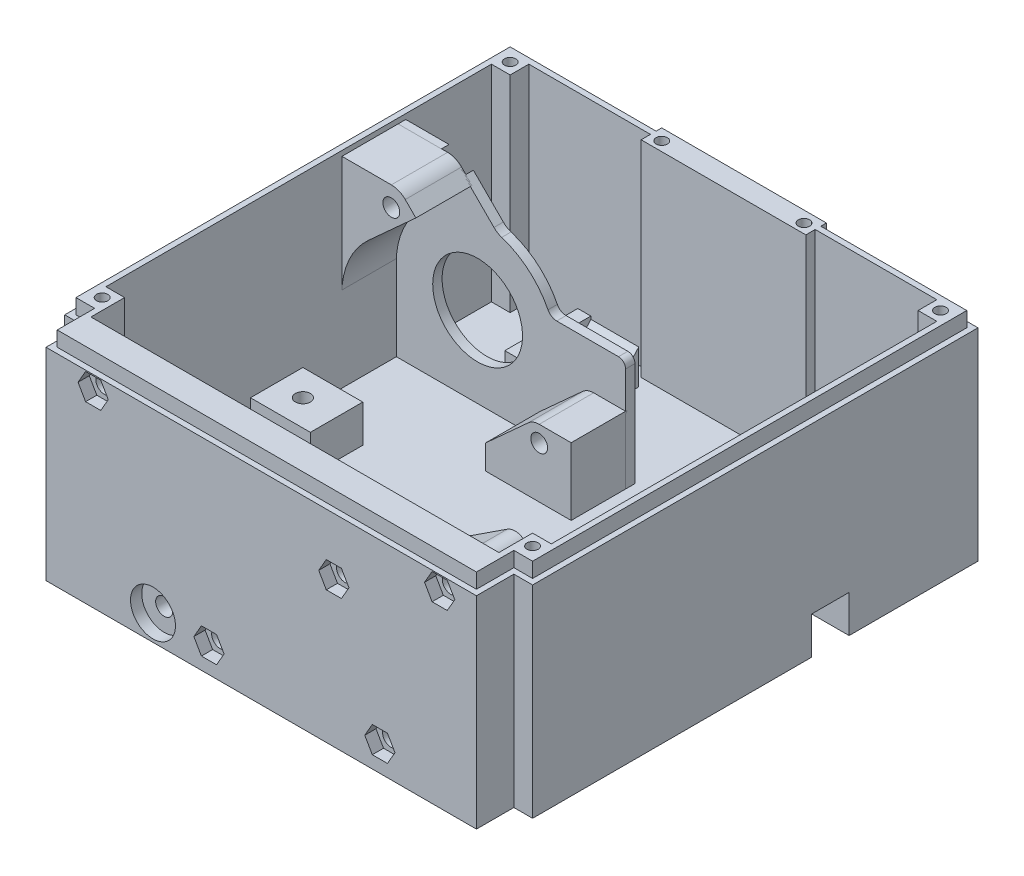
from build123d import *

# Parameters (mm, degrees)
BOSS_EXTRUDE1_DEPTH          = 3
SKETCH2_R                    = 1.5
BOSS_EXTRUDE2_DEPTH          = 55
SKETCH14_R                   = 12
SKETCH14_W                   = 1.116798897
SKETCH14_H                   = 21.636114375
BOSS_EXTRUDE10_DEPTH         = 2.5
SKETCH21_R                   = 2.25
BOSS_EXTRUDE11_DEPTH         = 15
BOSS_EXTRUDE11_2_DEPTH       = 15
BOSS_EXTRUDE18_DEPTH         = 3
CUT_EXTRUDE_THIN2_DEPTH      = 107.913516451
CUT_EXTRUDE_THIN2_DEPTH_BACK = 4
BOSS_EXTRUDE14_DEPTH         = 14.15
CUT_EXTRUDE7_DEPTH           = 23
SKETCH24_R                   = 6
CUT_EXTRUDE8_DEPTH           = 3
BOSS_EXTRUDE15_REACH         = 107.316
BOSS_EXTRUDE15_END_RADIUS    = 12.0269
SKETCH23_W                   = 12.784976471
SKETCH23_H                   = 19.5
SKETCH28_W                   = 3.5
SKETCH28_H                   = 19.5
BOSS_EXTRUDE16_DEPTH         = 10
SKETCH29_W                   = 6
SKETCH29_H                   = 2.5
CUT_EXTRUDE9_DEPTH           = 21
SKETCH31_R                   = 5.5
SKETCH31_R_2                 = 2.25
CUT_EXTRUDE10_DEPTH          = 2
SKETCH32_W                   = 16
SKETCH32_H                   = 14
SKETCH32_H_2                 = 16
BOSS_EXTRUDE19_DEPTH         = 10
SKETCH33_W                   = 16
SKETCH33_H                   = 10
CUT_EXTRUDE11_DEPTH          = 10
SKETCH34_R                   = 2
CUT_EXTRUDE12_DEPTH          = 10


with BuildPart() as part:
    # Sketch1 → Boss-Extrude1 (new body)
    with BuildSketch(Plane(origin=(0, 0, 0), x_dir=(1, 0, 0), z_dir=(0, 1, 0))):
        Polygon((-57.5, -54.5), (-57.5, -64.5), (57.5, -64.5), (57.5, -54.5), (62.5, -54.5), (62.5, 64.5), (-62.5, 64.5), (-62.5, -54.5), align=None)
    extrude(amount=BOSS_EXTRUDE1_DEPTH)

    # Sketch2 → Boss-Extrude2 (add)
    with BuildSketch(Plane(origin=(0, 3, 0), x_dir=(1, 0, 0), z_dir=(0, 1, 0))):
        Polygon((57.5, -64.5), (57.5, -54.5), (62.5, -54.5), (62.5, 64.5), (0, 64.5), (-62.5, 64.5), (-62.5, -54.5), (-57.5, -54.5), (-57.5, -64.5), align=None)
        with Locations(Location((-57.5, -49.5, 0), (0, 0, 270))):
            Circle(SKETCH2_R, mode=Mode.SUBTRACT)
        Polygon((-22, 59), (22, 59), (22, 61.5), (54.5, 61.5), (54.5, 56.5), (59.5, 56.5), (59.5, -46.5), (54.5, -46.5), (54.5, -58.5), (-54.5, -58.5), (-54.5, -46.5), (-59.5, -46.5), (-59.5, 56.5), (-54.5, 56.5), (-54.5, 61.5), (-22, 61.5), align=None, mode=Mode.SUBTRACT)
        with Locations(Location((-57.5, 59.5, 0), (0, 0, 270))):
            Circle(SKETCH2_R, mode=Mode.SUBTRACT)
        with Locations(Location((-19, 61.5, 0), (0, 0, 270))):
            Circle(SKETCH2_R, mode=Mode.SUBTRACT)
        with Locations(Location((19, 61.5, 0), (0, 0, 270))):
            Circle(SKETCH2_R, mode=Mode.SUBTRACT)
        with Locations(Location((57.5, 59.5, 0), (0, 0, 270))):
            Circle(SKETCH2_R, mode=Mode.SUBTRACT)
        with Locations(Location((57.5, -49.5, 0), (0, 0, 270))):
            Circle(SKETCH2_R, mode=Mode.SUBTRACT)
    extrude(amount=BOSS_EXTRUDE2_DEPTH)

    # Sketch30 → Boss-Extrude18 (add)
    with BuildSketch(Plane(origin=(0, 0, 58.5), x_dir=(-1, 0, 0), z_dir=(0, 0, -1))):
        with BuildLine():
            Line((54.5, 28.50000001), (54.5, 58))
            Line((54.5, 58), (-54.5, 58))
            Line((-54.5, 58), (-54.5, 3))
            Line((-54.5, 3), (13.717264207, 3))
            Line((13.717264207, 3), (-4.931615029, 5.361896936))
            ThreePointArc((-4.931615029, 5.361896936), (-14.898890302, 10.119374153), (-20.065130462, 19.881040427))
            Line((-20.065130462, 19.881040427), (-23.157396088, 38.179135111))
            ThreePointArc((-23.157396088, 38.179135111), (-22.149967828, 41.451692308), (-18.921946876, 42.593805718))
            Line((-18.921946876, 42.593805718), (-0.511473267, 40.262103064))
            ThreePointArc((-0.511473267, 40.262103064), (9.455802006, 35.504625847), (14.622042166, 25.742959573))
            Line((14.622042166, 25.742959573), (18.46546266, 3))
            Line((18.46546266, 3), (26.071580329, 3))
            Line((26.071580329, 3), (20.034760857, 23.540167479))
            ThreePointArc((20.034760857, 23.540167479), (20.404648352, 34.578434964), (27.282125622, 43.220221367))
            Line((27.282125622, 43.220221367), (42.812477849, 53.378495603))
            ThreePointArc((42.812477849, 53.378495603), (46.214674819, 53.765274725), (48.553441067, 51.264331954))
            Line((48.553441067, 51.264331954), (53.786239143, 33.459832521))
            ThreePointArc((53.786239143, 33.459832521), (54.320645373, 31.005463695), (54.5, 28.50000001))
        make_face()
        with BuildLine():
            Line((54.5, 3), (54.5, 28.50000001))
            ThreePointArc((54.5, 28.50000001), (52.382229081, 20.132437064), (46.538874378, 13.779778633))
            Line((46.538874378, 13.779778633), (30.058342822, 3))
            Line((30.058342822, 3), (54.5, 3))
        make_face()
    extrude(amount=BOSS_EXTRUDE18_DEPTH)

    # Sketch22 → Cut-Extrude-Thin2 (cut, two sides: drawn at the far end of the back side and taken through both)
    with BuildSketch(Plane(origin=(0, 58, 0), x_dir=(1, 0, 0), z_dir=(0, 1, 0)).offset(-CUT_EXTRUDE_THIN2_DEPTH_BACK)):
        Polygon((-22, 64.5), (-62.5, 64.5), (-62.5, -54.5), (-57.5, -54.5), (-57.5, -64.5), (57.5, -64.5), (57.5, -54.5), (62.5, -54.5), (62.5, 64.5), (22, 64.5), (22, 63), (61, 63), (61, -53), (56, -53), (56, -63), (-56, -63), (-56, -53), (-61, -53), (-61, 63), (-22, 63), align=None)
    extrude(amount=CUT_EXTRUDE_THIN2_DEPTH + CUT_EXTRUDE_THIN2_DEPTH_BACK, mode=Mode.SUBTRACT)

    # Sketch26 → Boss-Extrude14 (add)
    with BuildSketch(Plane(origin=(0, 0, 58.5), x_dir=(-1, 0, 0), z_dir=(0, 0, -1))):
        with BuildLine():
            Line((-32.835842822, 3), (-28.849080329, 3))
            Line((-28.849080329, 3), (-22.812260857, 23.540167479))
            ThreePointArc((-22.812260857, 23.540167479), (-23.182148352, 34.578434964), (-30.059625622, 43.220221367))
            Line((-30.059625622, 43.220221367), (-45.589977849, 53.378495603))
            ThreePointArc((-45.589977849, 53.378495603), (-48.992174819, 53.765274725), (-51.330941067, 51.264331954))
            Line((-51.330941067, 51.264331954), (-56.563739143, 33.459832521))
            ThreePointArc((-56.563739143, 33.459832521), (-56.193851648, 22.421565036), (-49.316374378, 13.779778633))
            Line((-49.316374378, 13.779778633), (-32.835842822, 3))
        make_face()
    extrude(amount=BOSS_EXTRUDE14_DEPTH)

    # Sketch9 → Cut-Extrude7 (cut)
    with BuildSketch(Plane.XY.offset(64.5)):
        with BuildLine():
            ThreePointArc((-42.752881471, 50.979977107), (-45.688023414, 52.335164835), (-47.043211142, 49.400022893))
            ThreePointArc((-47.043211142, 49.400022893), (-44.108069199, 48.044835165), (-42.752881471, 50.979977107))
        make_face()
        with BuildLine():
            ThreePointArc((-31.068118529, 6.020022893), (-28.132976586, 4.664835165), (-26.777788858, 7.599977107))
            ThreePointArc((-26.777788858, 7.599977107), (-29.712930801, 8.955164835), (-31.068118529, 6.020022893))
        make_face()
        with BuildLine():
            ThreePointArc((-15.540189678, 8.459583143), (-15.607157436, 5.227384615), (-12.374958909, 5.160416857))
            ThreePointArc((-12.374958909, 5.160416857), (-12.307991151, 8.392615385), (-15.540189678, 8.459583143))
        make_face()
        with BuildLine():
            ThreePointArc((20.983277975, 37.164416857), (21.050245733, 40.396615385), (17.818047205, 40.463583143))
            ThreePointArc((17.818047205, 40.463583143), (17.751079447, 37.231384615), (20.983277975, 37.164416857))
        make_face()
        with BuildLine():
            ThreePointArc((29.555288858, 7.599977107), (30.910476586, 4.664835165), (33.845618529, 6.020022893))
            ThreePointArc((33.845618529, 6.020022893), (32.490430801, 8.955164835), (29.555288858, 7.599977107))
        make_face()
        with BuildLine():
            ThreePointArc((49.820711142, 49.400022893), (48.465523414, 52.335164835), (45.530381471, 50.979977107))
            ThreePointArc((45.530381471, 50.979977107), (46.885569199, 48.044835165), (49.820711142, 49.400022893))
        make_face()
    extrude(amount=-CUT_EXTRUDE7_DEPTH, mode=Mode.SUBTRACT)

    # Sketch24 → Cut-Extrude8 (cut)
    with BuildSketch(Plane.XY.offset(64.5)):
        with Locations((-28.922953693, 6.81)):
            Circle(SKETCH24_R)
        Polygon((-40.856594422, 50.19), (-42.877320364, 53.69), (-46.918772249, 53.69), (-48.939498191, 50.19), (-46.918772249, 46.69), (-42.877320364, 46.69), align=None)
        Polygon((51.716998191, 50.19), (49.696272249, 53.69), (45.654820364, 53.69), (43.634094422, 50.19), (45.654820364, 46.69), (49.696272249, 46.69), align=None)
        Polygon((35.741905578, 6.81), (33.721179636, 10.31), (29.679727751, 10.31), (27.659001809, 6.81), (29.679727751, 3.31), (33.721179636, 3.31), align=None)
        Polygon((-9.916122409, 6.81), (-11.936848352, 10.31), (-15.978300236, 10.31), (-17.999026178, 6.81), (-15.978300236, 3.31), (-11.936848352, 3.31), align=None)
        Polygon((23.442114474, 38.814), (21.421388532, 42.314), (17.379936648, 42.314), (15.359210706, 38.814), (17.379936648, 35.314), (21.421388532, 35.314), align=None)
    extrude(amount=-CUT_EXTRUDE8_DEPTH, mode=Mode.SUBTRACT)

    # Boss-Extrude15: up to this cylinder (the profile starts outside it)
    boss_extrude15_end = Plane(origin=(0, 19.5875, -46.975), z_dir=(-1, 0, 0)) * Cylinder(BOSS_EXTRUDE15_END_RADIUS, 292.760292, mode=Mode.PRIVATE)
    # Sketch23 → Boss-Extrude15 (add, up to the surface)
    with BuildSketch(Plane(origin=(0, 3, 0), x_dir=(1, 0, 0), z_dir=(0, 1, 0)), mode=Mode.PRIVATE) as boss_extrude15_sk1:
        with Locations((26.537246289, 46.75)):
            Rectangle(SKETCH23_W, SKETCH23_H)
    boss_extrude15_tool1 = extrude(boss_extrude15_sk1.sketch, amount=BOSS_EXTRUDE15_REACH, mode=Mode.PRIVATE) - boss_extrude15_end
    add(boss_extrude15_tool1.solids().sort_by_distance((26.537246, 3, -46.75))[0])
    # Sketch23 → Boss-Extrude15 (add, up to the surface)
    with BuildSketch(Plane(origin=(0, 3, 0), x_dir=(1, 0, 0), z_dir=(0, 1, 0)), mode=Mode.PRIVATE) as boss_extrude15_sk2:
        with Locations((-26.537246289, 46.75)):
            Rectangle(SKETCH23_W, SKETCH23_H)
    boss_extrude15_tool2 = extrude(boss_extrude15_sk2.sketch, amount=BOSS_EXTRUDE15_REACH, mode=Mode.PRIVATE) - boss_extrude15_end
    add(boss_extrude15_tool2.solids().sort_by_distance((-26.537246, 3, -46.75))[0])

    # Sketch28 → Boss-Extrude16 (add)
    with BuildSketch(Plane(origin=(0, 3, 0), x_dir=(1, 0, 0), z_dir=(0, 1, 0))):
        with Locations((-34.679734524, 46.75)):
            Rectangle(SKETCH28_W, SKETCH28_H)
        with Locations((34.679734524, 46.75)):
            Rectangle(SKETCH28_W, SKETCH28_H)
    extrude(amount=BOSS_EXTRUDE16_DEPTH)

    # Sketch29 → Cut-Extrude9 (cut)
    with BuildSketch(Plane.XY.offset(-37)):
        with Locations((-26.800748972, 4.264488043)):
            Rectangle(SKETCH29_W, SKETCH29_H)
        with Locations((26.902468668, 4.264488043)):
            Rectangle(SKETCH29_W, SKETCH29_H)
    extrude(amount=-CUT_EXTRUDE9_DEPTH, mode=Mode.SUBTRACT)

    # Sketch32 → Boss-Extrude19 (add)
    with BuildSketch(Plane(origin=(0, 3, 0), x_dir=(1, 0, 0), z_dir=(0, 1, 0))):
        with Locations((-51.5, -0.870941626)):
            Rectangle(SKETCH32_W, SKETCH32_H)
        with Locations((51.5, 25.061631492)):
            Rectangle(SKETCH32_W, SKETCH32_H_2)
    extrude(amount=BOSS_EXTRUDE19_DEPTH)

    # Sketch33 → Cut-Extrude11 (cut)
    with BuildSketch(Plane.XZ):
        with Locations((54.5, -25.061631492)):
            Rectangle(SKETCH33_W, SKETCH33_H)
        with Locations((-54.5, 0.870941626)):
            Rectangle(SKETCH33_W, SKETCH33_H)
    extrude(amount=-CUT_EXTRUDE11_DEPTH, mode=Mode.SUBTRACT)

    # Sketch34 → Cut-Extrude12 (cut)
    with BuildSketch(Plane(origin=(0, 13, 0), x_dir=(1, 0, 0), z_dir=(0, 1, 0))):
        with Locations(Location((52.5, 25.061631492, 0), (0, 0, 270))):
            Circle(SKETCH34_R)
        with Locations(Location((-52.5, -0.870941626, 0), (0, 0, 270))):
            Circle(SKETCH34_R)
    extrude(amount=-CUT_EXTRUDE12_DEPTH, mode=Mode.SUBTRACT)


with BuildPart() as body_2:
    # Sketch14 → Boss-Extrude10 (new body)
    # profile 1 of 10: a face of its own
    with BuildSketch(Plane(origin=(0, 0, -31.119001714), x_dir=(-1, 0, 0), z_dir=(0, 0, -1))):
        with BuildLine():
            ThreePointArc((-1.59584635, 23.545273827), (-1.697128881, 23.891187217), (-1.731299201, 24.25))
            Line((-1.731299201, 24.25), (-1.731299201, 3))
            Line((-1.731299201, 3), (58.856776147, 3))
            Line((58.856776147, 3), (58.856776147, 24.636114375))
            ThreePointArc((58.856776147, 24.636114375), (46.326717946, 5.386759507), (23.652937249, 9.052777819))
            Line((23.652937249, 9.052777819), (20.029318508, 12.343765137))
            ThreePointArc((20.029318508, 12.343765137), (18.95461959, 13.077151659), (17.720322917, 13.488667491))
            Line((17.720322917, 13.488667491), (18.204971966, 13.049203274))
            add(Edge.make_bspline(
                [(18.204971966, 13.049203274), (17.633265391, 13.567608463), (16.861430926, 13.567608463)],
                knots=[0.344197313, 0.344197313, 0.344197313, 1.080722269, 1.080722269, 1.080722269], degree=2, weights=[1, 0.932954253, 1]))
            Line((16.861430926, 13.567608463), (11.576216454, 13.567608463))
            add(Edge.make_bspline(
                [(11.576216454, 13.567608463), (11.161964807, 13.567608463), (10.869078119, 13.274721775)],
                knots=[5.212883045, 5.212883045, 5.212883045, 5.998256201, 5.998256201, 5.998256201], degree=2, weights=[1, 0.923884317, 1]))
            Line((10.869078119, 13.274721775), (10.51813319, 12.923776846))
            ThreePointArc((10.51813319, 12.923776846), (5.894136115, 11.465836169), (2.047645264, 14.417352407))
            Line((2.047645264, 14.417352407), (-1.61850388, 22.279505041))
            add(Edge.make_bspline(
                [(-1.61850388, 22.279505041), (-1.303116197, 21.995089756), (-0.911492557, 21.830784457)],
                knots=[0.051587875, 0.051587875, 0.051587875, 0.388465815, 0.388465815, 0.388465815], degree=2, weights=[1, 0.969446087, 0.966947037]))
            Line((-0.911492557, 21.830784457), (-1.59584635, 23.545273827))
        make_face()
    # profile 2 of 10: a face of its own
    with BuildSketch(Plane(origin=(0, 0, -31.119001714), x_dir=(-1, 0, 0), z_dir=(0, 0, -1))):
        with BuildLine():
            Line((-1.731299201, 30.772228751), (-1.731299201, 24.25))
            ThreePointArc((-1.731299201, 24.25), (-1.697128881, 23.891187217), (-1.59584635, 23.545273827))
            ThreePointArc((-1.59584635, 23.545273827), (-0.89663389, 22.67624692), (0.169681285, 22.349019514))
            Line((0.169681285, 22.349019514), (6.849741216, 22.349019514))
            ThreePointArc((6.849741216, 22.349019514), (8.867461366, 21.972817718), (10.614037633, 20.894766821))
            Line((10.614037633, 20.894766821), (20.029318508, 12.343765137))
            Line((20.029318508, 12.343765137), (23.652937249, 9.052777819))
            ThreePointArc((23.652937249, 9.052777819), (46.326717946, 5.386759507), (58.856776147, 24.636114375))
            ThreePointArc((58.856776147, 24.636114375), (57.121955076, 33.004493243), (52.203426683, 39.993588138))
            ThreePointArc((52.203426683, 39.993588138), (42.422819909, 45.174538524), (31.365884521, 44.67785392))
            ThreePointArc((31.365884521, 44.67785392), (24.122107987, 40.633003795), (19.00380593, 34.103371718))
            ThreePointArc((19.00380593, 34.103371718), (18.045725644, 33.059449427), (16.682453808, 32.673209237))
            Line((16.682453808, 32.673209237), (0.169681285, 32.673209237))
            ThreePointArc((0.169681285, 32.673209237), (-1.174514908, 32.116424943), (-1.731299201, 30.772228751))
        make_face()
        with Locations((37.80579566, 24.636114375)):
            Circle(SKETCH14_R, mode=Mode.SUBTRACT)
    # profile 3 of 10: a face of its own
    with BuildSketch(Plane(origin=(0, 0, -31.119001714), x_dir=(-1, 0, 0), z_dir=(0, 0, -1))):
        with BuildLine():
            ThreePointArc((0.169681285, 22.349019514), (-0.89663389, 22.67624692), (-1.59584635, 23.545273827))
            Line((-1.59584635, 23.545273827), (-0.911492557, 21.830784457))
            add(Edge.make_bspline(
                [(-0.911492557, 21.830784457), (-0.447494096, 21.636114375), (0.055700468, 21.636114375)],
                knots=[0.388465815, 0.388465815, 0.388465815, 0.785360087, 0.785360087, 0.785360087], degree=2, weights=[0.966947037, 0.964002769, 1]))
            Line((0.055700468, 21.636114375), (6.805869125, 21.636114375))
            add(Edge.make_bspline(
                [(10.164391553, 20.340143754), (8.735171821, 21.636114375), (6.805869125, 21.636114375)],
                knots=[5.914929134, 5.914929134, 5.914929134, 6.651441481, 6.651441481, 6.651441481], degree=2, weights=[1, 0.932956522, 1]))
            Line((10.164391553, 20.340143754), (17.720322917, 13.488667491))
            ThreePointArc((17.720322917, 13.488667491), (18.95461959, 13.077151659), (20.029318508, 12.343765137))
            Line((20.029318508, 12.343765137), (10.614037633, 20.894766821))
            ThreePointArc((10.614037633, 20.894766821), (8.867461366, 21.972817718), (6.849741216, 22.349019514))
            Line((6.849741216, 22.349019514), (0.169681285, 22.349019514))
        make_face()
    # profile 4 of 10: a face of its own
    with BuildSketch(Plane(origin=(0, 0, -31.119001714), x_dir=(-1, 0, 0), z_dir=(0, 0, -1))):
        with Locations((59.415175596, 13.818057188)):
            Rectangle(SKETCH14_W, SKETCH14_H)
    # profile 5 of 10: a face of its own
    with BuildSketch(Plane(origin=(0, 0, -31.119001714), x_dir=(-1, 0, 0), z_dir=(0, 0, -1))):
        with BuildLine():
            add(Edge.make_bspline(
                [(-0.911492557, 21.830784457), (-0.447494096, 21.636114375), (0.055700468, 21.636114375)],
                knots=[0.388465815, 0.388465815, 0.388465815, 0.785360087, 0.785360087, 0.785360087], degree=2, weights=[0.966947037, 0.964002769, 1]))
            Line((-0.911492557, 21.830784457), (2.047645264, 14.417352407))
            ThreePointArc((2.047645264, 14.417352407), (5.894136115, 11.465836169), (10.51813319, 12.923776846))
            Line((10.51813319, 12.923776846), (10.869078119, 13.274721775))
            add(Edge.make_bspline(
                [(11.576216454, 13.567608463), (11.161964807, 13.567608463), (10.869078119, 13.274721775)],
                knots=[5.212883045, 5.212883045, 5.212883045, 5.998256201, 5.998256201, 5.998256201], degree=2, weights=[1, 0.923884317, 1]))
            Line((11.576216454, 13.567608463), (16.861430926, 13.567608463))
            ThreePointArc((16.861430926, 13.567608463), (17.292686978, 13.547831717), (17.720322917, 13.488667491))
            Line((17.720322917, 13.488667491), (10.164391553, 20.340143754))
            add(Edge.make_bspline(
                [(10.164391553, 20.340143754), (8.735171821, 21.636114375), (6.805869125, 21.636114375)],
                knots=[5.914929134, 5.914929134, 5.914929134, 6.651441481, 6.651441481, 6.651441481], degree=2, weights=[1, 0.932956522, 1]))
            Line((6.805869125, 21.636114375), (0.055700468, 21.636114375))
        make_face()
        with BuildLine():
            ThreePointArc((9.052712114, 16.518358474), (6.688039759, 14.389197922), (4.558879207, 16.753870277))
            ThreePointArc((4.558879207, 16.753870277), (6.923551562, 18.883030829), (9.052712114, 16.518358474))
        make_face(mode=Mode.SUBTRACT)
    # profile 6 of 10: a face of its own
    with BuildSketch(Plane(origin=(0, 0, -31.119001714), x_dir=(-1, 0, 0), z_dir=(0, 0, -1))):
        with BuildLine():
            Line((2.047645264, 14.417352407), (-0.911492557, 21.830784457))
            add(Edge.make_bspline(
                [(-1.61850388, 22.279505041), (-1.303116197, 21.995089756), (-0.911492557, 21.830784457)],
                knots=[0.051587875, 0.051587875, 0.051587875, 0.388465815, 0.388465815, 0.388465815], degree=2, weights=[1, 0.969446087, 0.966947037]))
            Line((-1.61850388, 22.279505041), (2.047645264, 14.417352407))
        make_face()
    # profile 7 of 10: a face of its own
    with BuildSketch(Plane(origin=(0, 0, -31.119001714), x_dir=(-1, 0, 0), z_dir=(0, 0, -1))):
        with BuildLine():
            ThreePointArc((52.203426683, 39.993588138), (57.121955076, 33.004493243), (58.856776147, 24.636114375))
            Line((58.856776147, 24.636114375), (59.973575044, 24.636114375))
            Line((59.973575044, 24.636114375), (59.973575044, 56.636152457))
            Line((59.973575044, 56.636152457), (46.30579566, 56.636152457))
            ThreePointArc((46.30579566, 56.636152457), (50.01813319, 55.098451905), (51.555833742, 51.386114375))
            Line((51.555833742, 51.386114375), (51.555833742, 41.48838285))
            ThreePointArc((51.555833742, 41.48838285), (51.724689728, 40.673860314), (52.203426683, 39.993588138))
        make_face()
    # profile 8 of 10: a face of its own
    with BuildSketch(Plane(origin=(0, 0, -31.119001714), x_dir=(-1, 0, 0), z_dir=(0, 0, -1))):
        with BuildLine():
            ThreePointArc((31.365884521, 44.67785392), (42.422819909, 45.174538524), (52.203426683, 39.993588138))
            ThreePointArc((52.203426683, 39.993588138), (51.724689728, 40.673860314), (51.555833742, 41.48838285))
            ThreePointArc((51.555833742, 41.48838285), (42.998855018, 45.757066875), (33.438051696, 45.94304547))
            ThreePointArc((33.438051696, 45.94304547), (32.477362773, 45.186966142), (31.365884521, 44.67785392))
        make_face()
    # profile 9 of 10: a face of its own
    with BuildSketch(Plane(origin=(0, 0, -31.119001714), x_dir=(-1, 0, 0), z_dir=(0, 0, -1))):
        with BuildLine():
            ThreePointArc((33.438051696, 45.94304547), (42.998855018, 45.757066875), (51.555833742, 41.48838285))
            Line((51.555833742, 41.48838285), (51.555833742, 51.386114375))
            ThreePointArc((51.555833742, 51.386114375), (50.01813319, 55.098451905), (46.30579566, 56.636152457))
            ThreePointArc((46.30579566, 56.636152457), (44.296693067, 56.236517104), (42.593458131, 55.098451905))
            Line((42.593458131, 55.098451905), (33.438051696, 45.94304547))
        make_face()
        with BuildLine():
            ThreePointArc((48.552712114, 51.268358474), (46.188039759, 49.139197922), (44.058879207, 51.503870277))
            ThreePointArc((44.058879207, 51.503870277), (46.423551562, 53.633030829), (48.552712114, 51.268358474))
        make_face(mode=Mode.SUBTRACT)
    # profile 10 of 10: a face of its own
    with BuildSketch(Plane(origin=(0, 0, -31.119001714), x_dir=(-1, 0, 0), z_dir=(0, 0, -1))):
        with BuildLine():
            Line((18.204971966, 13.049203274), (17.720322917, 13.488667491))
            ThreePointArc((17.720322917, 13.488667491), (17.292686978, 13.547831717), (16.861430926, 13.567608463))
            add(Edge.make_bspline(
                [(18.204971966, 13.049203274), (17.633265391, 13.567608463), (16.861430926, 13.567608463)],
                knots=[0.344197313, 0.344197313, 0.344197313, 1.080722269, 1.080722269, 1.080722269], degree=2, weights=[1, 0.932954253, 1]))
        make_face()
    extrude(amount=BOSS_EXTRUDE10_DEPTH)

    # Sketch31 → Cut-Extrude10 (cut)
    # profile 1 of 2: a face of its own
    with BuildSketch(Plane(origin=(0, 0, -33.619001714), x_dir=(-1, 0, 0), z_dir=(0, 0, -1))):
        with Locations((6.80579566, 16.636114375)):
            Circle(SKETCH31_R)
        with Locations((6.80579566, 16.636114375)):
            Circle(SKETCH31_R_2, mode=Mode.SUBTRACT)
    # profile 2 of 2: a face of its own
    with BuildSketch(Plane(origin=(0, 0, -33.619001714), x_dir=(-1, 0, 0), z_dir=(0, 0, -1))):
        with Locations((46.30579566, 51.386114375)):
            Circle(SKETCH31_R)
    extrude(amount=-CUT_EXTRUDE10_DEPTH, mode=Mode.SUBTRACT)


with BuildPart() as body_3:
    # Sketch21 → Boss-Extrude11 (new body)
    with BuildSketch(Plane(origin=(0, 0, -16.569001714), x_dir=(-1, 0, 0), z_dir=(0, 0, -1))):
        with BuildLine():
            Line((59.973575044, 24.636114375), (59.973575044, 56.636152457))
            Line((59.973575044, 56.636152457), (46.30579566, 56.636152457))
            ThreePointArc((46.30579566, 56.636152457), (44.296693067, 56.236517104), (42.593458131, 55.098451905))
            Line((42.593458131, 55.098451905), (39.748267562, 52.253261335))
            Line((39.748267562, 52.253261335), (52.428614329, 40.73691169))
            ThreePointArc((52.428614329, 40.73691169), (57.694345206, 33.439982672), (59.55579566, 24.636114375))
            Line((59.55579566, 24.636114375), (59.973575044, 24.636114375))
        make_face()
        with Locations((46.30579566, 51.386114375)):
            Circle(SKETCH21_R, mode=Mode.SUBTRACT)
    extrude(amount=BOSS_EXTRUDE11_DEPTH)


with BuildPart() as body_4:
    # Sketch21 → Boss-Extrude11 2 (new body)
    with BuildSketch(Plane(origin=(0, 0, -16.569001714), x_dir=(-1, 0, 0), z_dir=(0, 0, -1))):
        with BuildLine():
            Line((-1.731299201, 20.990217365), (-1.731299201, 3))
            Line((-1.731299201, 3), (21.142157347, 3))
            Line((21.142157347, 3), (21.142157347, 9.497568685))
            Line((21.142157347, 9.497568685), (9.733117889, 19.859311144))
            ThreePointArc((9.733117889, 19.859311144), (8.374884912, 20.697662327), (6.80579566, 20.990217365))
            Line((6.80579566, 20.990217365), (-1.731299201, 20.990217365))
        make_face()
        with Locations((6.80579566, 16.636114375)):
            Circle(SKETCH21_R, mode=Mode.SUBTRACT)
    extrude(amount=BOSS_EXTRUDE11_2_DEPTH)


solid = Compound([part.part, body_2.part, body_3.part, body_4.part])
